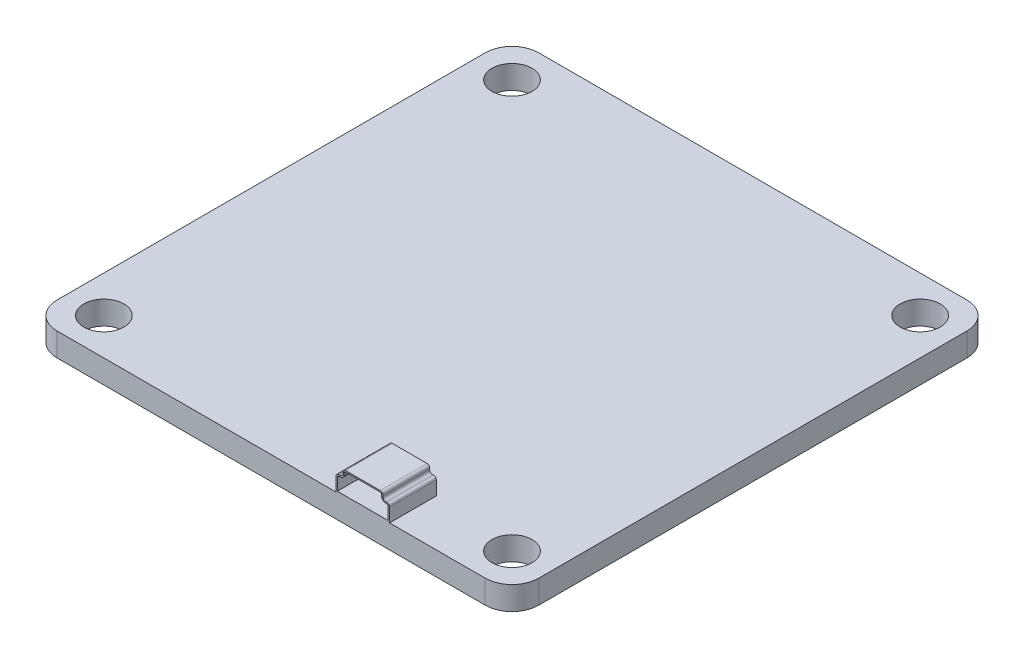
from build123d import *

# Parameters (mm, degrees)
SKETCH2_R           = 1.5
BOSS_EXTRUDE1_DEPTH = 1.75
BOSS_EXTRUDE2_DEPTH = 3
BOSS_EXTRUDE3_DEPTH = 0.5
SKETCH6_R           = 0.25
CUT_EXTRUDE1_DEPTH  = 38.316216314


with BuildPart() as part:
    # Sketch2 → Boss-Extrude1 (new body)
    with BuildSketch(Plane(origin=(0, 0, 0), x_dir=(1, 0, 0), z_dir=(0, 1, 0))):
        with BuildLine():
            Line((16, -18), (-16, -18))
            ThreePointArc((-16, -18), (-17.414213562, -17.414213562), (-18, -16))
            Line((-18, -16), (-18, 16))
            ThreePointArc((-18, 16), (-17.414213562, 17.414213562), (-16, 18))
            Line((-16, 18), (16, 18))
            ThreePointArc((16, 18), (17.414213562, 17.414213562), (18, 16))
            Line((18, 16), (18, -16))
            ThreePointArc((18, -16), (17.414213562, -17.414213562), (16, -18))
        make_face()
        with Locations(Location((-15.25, 15.25, 0), (0, 0, 270))):
            Circle(SKETCH2_R, mode=Mode.SUBTRACT)
        with Locations(Location((15.25, 15.25, 0), (0, 0, 270))):
            Circle(SKETCH2_R, mode=Mode.SUBTRACT)
        with Locations(Location((15.25, -15.25, 0), (0, 0, 270))):
            Circle(SKETCH2_R, mode=Mode.SUBTRACT)
        with Locations(Location((-15.25, -15.25, 0), (0, 0, 270))):
            Circle(SKETCH2_R, mode=Mode.SUBTRACT)
    extrude(amount=BOSS_EXTRUDE1_DEPTH)

    # Sketch3 → Boss-Extrude2 (add)
    with BuildSketch(Plane.XY.offset(18)):
        with BuildLine():
            Line((5.557062961, 3.5), (8.150682516, 3.5))
            ThreePointArc((8.150682516, 3.5), (8.292103872, 3.441421356), (8.350682516, 3.3))
            Line((8.350682516, 3.3), (8.350682516, 3.184070744))
            ThreePointArc((8.350682516, 3.184070744), (8.40926116, 3.042649388), (8.550682516, 2.984070744))
            Line((8.550682516, 2.984070744), (8.650583865, 2.984070744))
            ThreePointArc((8.650583865, 2.984070744), (8.792005221, 2.925492101), (8.850583865, 2.784070744))
            Line((8.850583865, 2.784070744), (8.850583865, 1.75))
            Line((8.850583865, 1.75), (4.850583865, 1.75))
            Line((4.850583865, 1.75), (4.850583865, 2.784070744))
            ThreePointArc((4.850583865, 2.784070744), (4.909162509, 2.925492101), (5.050583865, 2.984070744))
            Line((5.050583865, 2.984070744), (5.157062961, 2.984070744))
            ThreePointArc((5.157062961, 2.984070744), (5.298484317, 3.042649388), (5.357062961, 3.184070744))
            Line((5.357062961, 3.184070744), (5.357062961, 3.3))
            ThreePointArc((5.357062961, 3.3), (5.415641605, 3.441421356), (5.557062961, 3.5))
        make_face()
        with BuildLine():
            Line((5.557062961, 3.4), (8.150682516, 3.4))
            ThreePointArc((8.150682516, 3.4), (8.221393194, 3.370710678), (8.250682516, 3.3))
            Line((8.250682516, 3.3), (8.250682516, 3.184070744))
            ThreePointArc((8.250682516, 3.184070744), (8.338550482, 2.97193871), (8.550682516, 2.884070744))
            Line((8.550682516, 2.884070744), (8.650583865, 2.884070744))
            ThreePointArc((8.650583865, 2.884070744), (8.721294543, 2.854781422), (8.750583865, 2.784070744))
            Line((8.750583865, 2.784070744), (8.750583865, 1.85))
            Line((8.750583865, 1.85), (4.950583865, 1.85))
            Line((4.950583865, 1.85), (4.950583865, 2.784070744))
            ThreePointArc((4.950583865, 2.784070744), (4.979873187, 2.854781422), (5.050583865, 2.884070744))
            Line((5.050583865, 2.884070744), (5.157062961, 2.884070744))
            ThreePointArc((5.157062961, 2.884070744), (5.369194995, 2.97193871), (5.457062961, 3.184070744))
            Line((5.457062961, 3.184070744), (5.457062961, 3.3))
            ThreePointArc((5.457062961, 3.3), (5.486352283, 3.370710678), (5.557062961, 3.4))
        make_face(mode=Mode.SUBTRACT)
    extrude(amount=-BOSS_EXTRUDE2_DEPTH)

    # Sketch5 → Boss-Extrude3 (add)
    with BuildSketch(Plane(origin=(0, 0, 15), x_dir=(-1, 0, 0), z_dir=(0, 0, -1))):
        with BuildLine():
            Line((-8.350682516, 3.3), (-8.350682516, 3.184070744))
            ThreePointArc((-8.350682516, 3.184070744), (-8.40926116, 3.042649388), (-8.550682516, 2.984070744))
            Line((-8.550682516, 2.984070744), (-8.650583865, 2.984070744))
            ThreePointArc((-8.650583865, 2.984070744), (-8.792005221, 2.925492101), (-8.850583865, 2.784070744))
            Line((-8.850583865, 2.784070744), (-8.850583865, 1.75))
            Line((-8.850583865, 1.75), (-4.850583865, 1.75))
            Line((-4.850583865, 1.75), (-4.850583865, 2.784070744))
            ThreePointArc((-4.850583865, 2.784070744), (-4.909162509, 2.925492101), (-5.050583865, 2.984070744))
            Line((-5.050583865, 2.984070744), (-5.157062961, 2.984070744))
            ThreePointArc((-5.157062961, 2.984070744), (-5.298484317, 3.042649388), (-5.357062961, 3.184070744))
            Line((-5.357062961, 3.184070744), (-5.357062961, 3.3))
            ThreePointArc((-5.357062961, 3.3), (-5.415641605, 3.441421356), (-5.557062961, 3.5))
            Line((-5.557062961, 3.5), (-8.150682516, 3.5))
            ThreePointArc((-8.150682516, 3.5), (-8.292103872, 3.441421356), (-8.350682516, 3.3))
        make_face()
    extrude(amount=BOSS_EXTRUDE3_DEPTH)

    # Sketch6 → Cut-Extrude1 (cut, through all)
    with BuildSketch(Plane(origin=(0, 0, 14.5), x_dir=(-1, 0, 0), z_dir=(0, 0, -1))):
        with Locations((-7.650583865, 2.218305959)):
            Circle(SKETCH6_R)
        with Locations((-6.850583865, 2.218305959)):
            Circle(SKETCH6_R)
        with Locations((-6.050583865, 2.218305959)):
            Circle(SKETCH6_R)
    extrude(amount=-CUT_EXTRUDE1_DEPTH, mode=Mode.SUBTRACT)


solid = part.part
